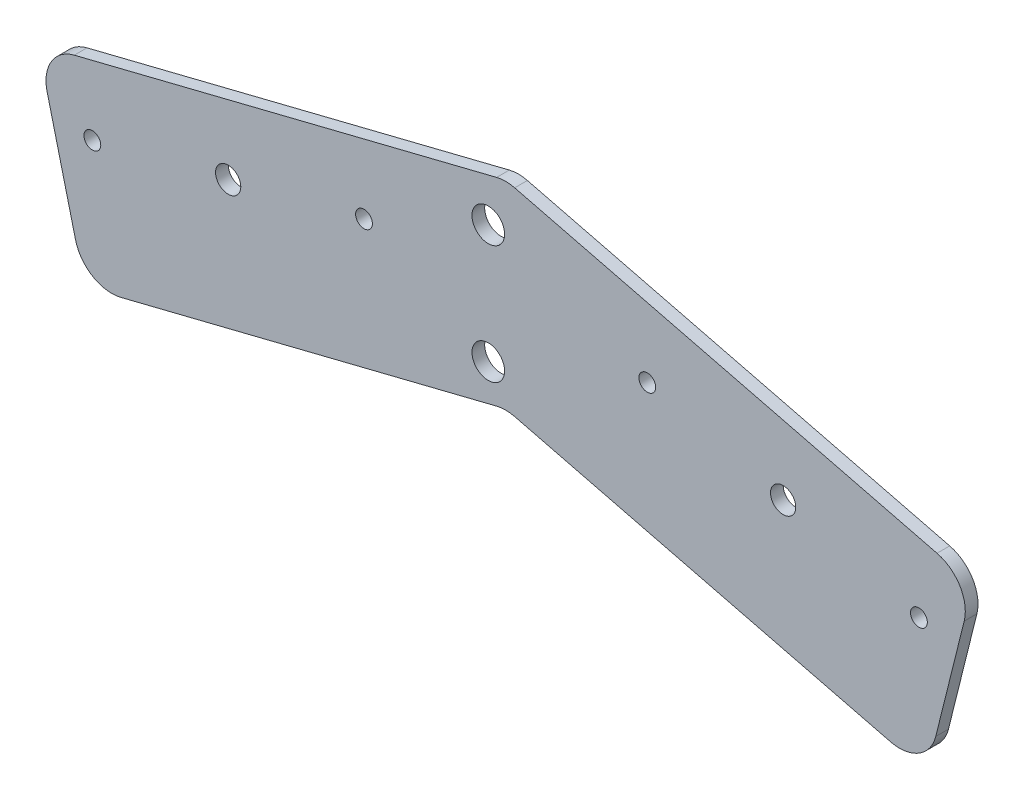
from build123d import *

# Parameters (mm, degrees)
BOSS_EXTRUDE1_DEPTH             = 3.4036
F_1_4_CLEARANCE_HOLE1_D         = 6.7564
M4_CLEARANCE_HOLE1_D            = 4.5
HOLE_FOR_1_4_300_SC_NUTS_SP_1_D = 8.7376


with BuildPart() as part:
    # Sketch1 → Boss-Extrude1 (new body)
    with BuildSketch(Plane.XY):
        with BuildLine():
            Line((-115.560967743, -45.044749956), (-2.419218956, -16.835343693))
            ThreePointArc((-2.419218956, -16.835343693), (0, -16.538300956), (2.419218956, -16.835343693))
            Line((2.419218956, -16.835343693), (115.560967743, -45.044749956))
            ThreePointArc((115.560967743, -45.044749956), (121.713421794, -49.59732647), (122.84470605, -57.166926175))
            Line((122.84470605, -57.166926175), (115.224166338, -87.731241553))
            ThreePointArc((115.224166338, -87.731241553), (110.671589825, -93.883695604), (103.101990119, -95.014979859))
            Line((103.101990119, -95.014979859), (2.419218956, -69.911945605))
            ThreePointArc((2.419218956, -69.911945605), (0, -69.614902867), (-2.419218956, -69.911945605))
            Line((-2.419218956, -69.911945605), (-103.101990119, -95.014979859))
            ThreePointArc((-103.101990119, -95.014979859), (-110.671589825, -93.883695604), (-115.224166338, -87.731241553))
            Line((-115.224166338, -87.731241553), (-122.84470605, -57.166926175))
            ThreePointArc((-122.84470605, -57.166926175), (-121.713421794, -49.59732647), (-115.560967743, -45.044749956))
        make_face()
    extrude(amount=-BOSS_EXTRUDE1_DEPTH)

    # 1/4 Clearance Hole1 (through all)
    with Locations(Plane.XY):
        with Locations((-74.335136024, -53.317040996), (74.335136024, -53.317040996)):
            Hole(F_1_4_CLEARANCE_HOLE1_D / 2)

    # M4 Clearance Hole1 (through all)
    with Locations(Plane.XY):
        with Locations((-110.721225759, -62.389112081), (-37.949046288, -44.244969911), (37.949046288, -44.244969911), (110.721225759, -62.389112081)):
            Hole(M4_CLEARANCE_HOLE1_D / 2)

    # Hole for 1/4 300® SC Nuts (SP)1 (through all)
    with Locations(Plane.XY):
        with Locations((-4.6482, -60.701560235), (-4.6482, -28.951560235)):
            Hole(HOLE_FOR_1_4_300_SC_NUTS_SP_1_D / 2)


solid = part.part
